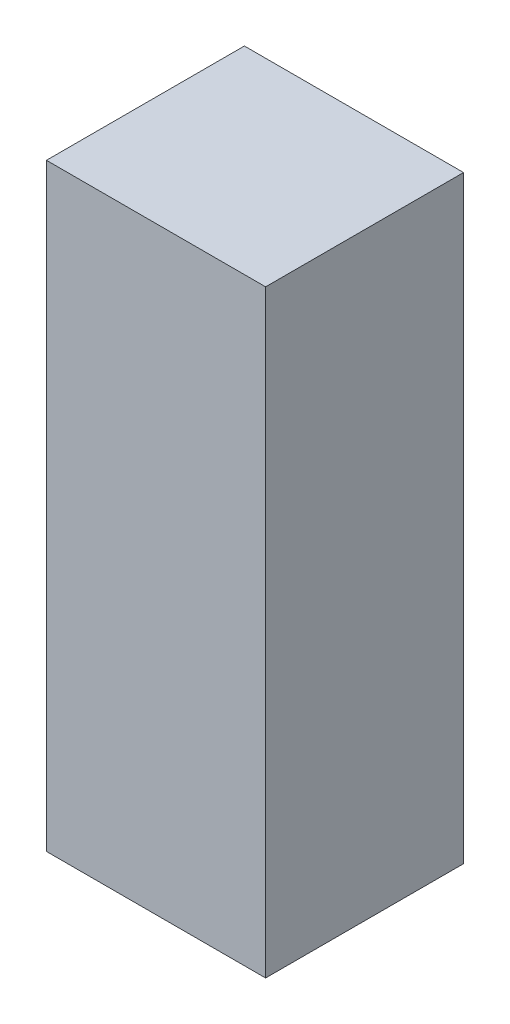
from build123d import *

# Parameters (mm, degrees)
SKETCH1_W           = 93
SKETCH1_H           = 84
BOSS_EXTRUDE1_DEPTH = 254


with BuildPart() as part:
    # Sketch1 → Boss-Extrude1 (new body)
    with BuildSketch(Plane(origin=(0, 0, 0), x_dir=(1, 0, 0), z_dir=(0, 1, 0))):
        with Locations((4.852173913, 17.439130435)):
            Rectangle(SKETCH1_W, SKETCH1_H)
    extrude(amount=BOSS_EXTRUDE1_DEPTH)


solid = part.part
